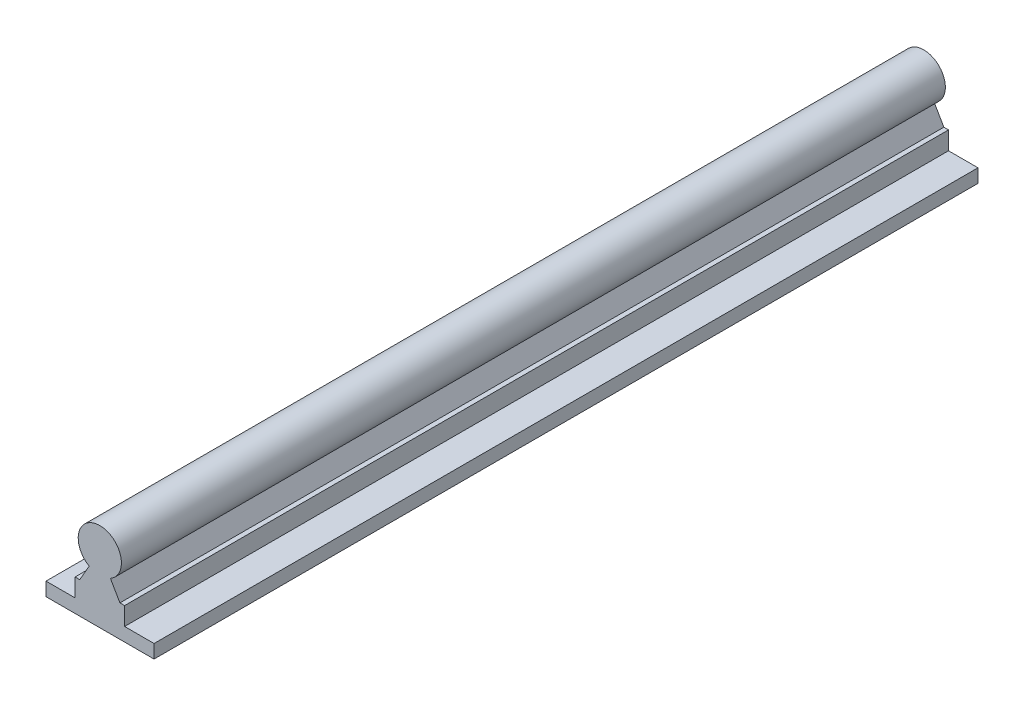
from build123d import *

# Parameters (mm, degrees)
BOSS_EXTRU_1_DEPTH = 305


with BuildPart() as part:
    # Esquisse1 → Boss.-Extru.1 (new body)
    with BuildSketch(Plane.XY):
        with BuildLine():
            Line((-25.931265673, -2.76101993), (-15.181265673, -2.76101993))
            Line((-15.181265673, -2.76101993), (-15.181265673, 3.93898007))
            Line((-15.181265673, 3.93898007), (-13.453102315, 3.93898007))
            Line((-13.453102315, 3.93898007), (-9.931265673, 10.03898007))
            ThreePointArc((-9.931265673, 10.03898007), (-6.010431334, 25.012290482), (-2.089596996, 10.03898007))
            Line((-2.089596996, 10.03898007), (1.432239646, 3.93898007))
            Line((1.432239646, 3.93898007), (3.160403004, 3.93898007))
            Line((3.160403004, 3.93898007), (3.160403004, -2.76101993))
            Line((3.160403004, -2.76101993), (14.068734327, -2.76101993))
            Line((14.068734327, -2.76101993), (14.068734327, -7.76101993))
            Line((14.068734327, -7.76101993), (-25.931265673, -7.76101993))
            Line((-25.931265673, -7.76101993), (-25.931265673, -2.76101993))
        make_face()
    extrude(amount=BOSS_EXTRU_1_DEPTH)


solid = part.part
